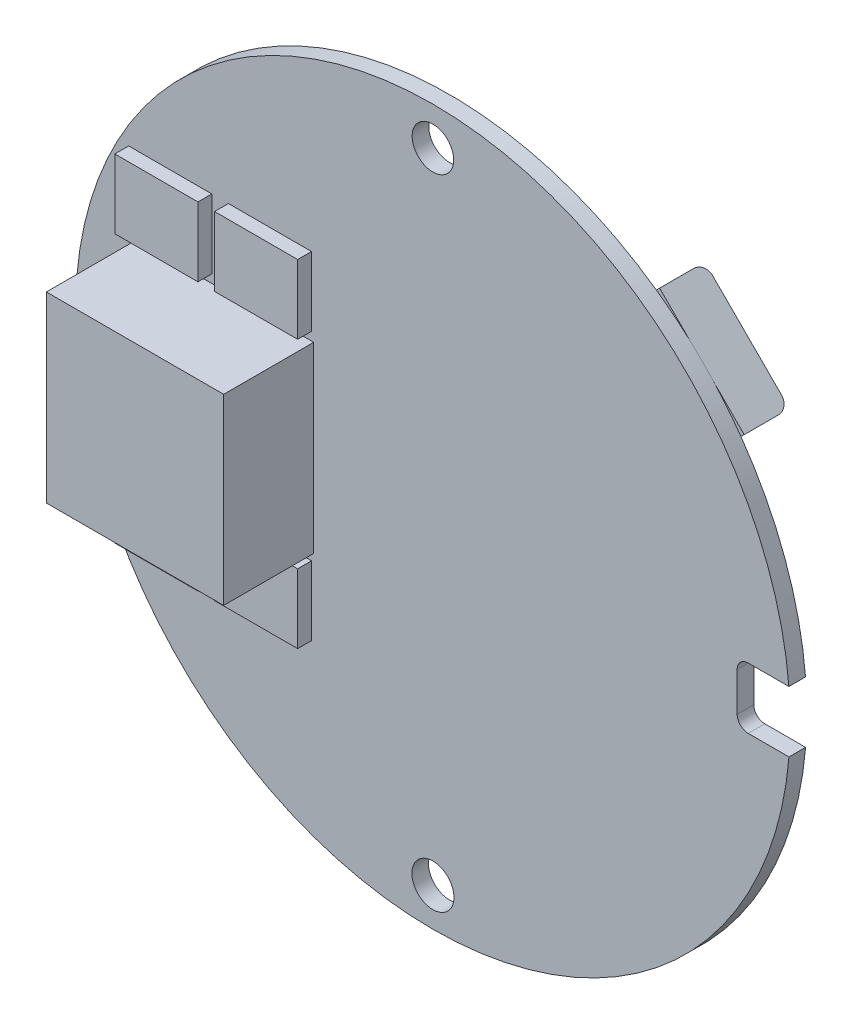
from build123d import *

# Parameters (mm, degrees)
EXTRUDE_START       = -49.800416
SKETCH_2_R          = 25.8
SKETCH_2_R_2        = 1.49999954
SKETCH_2_R_3        = 1.52
EXTRUDE_1_DEPTH     = 1.2
EXTRUDE_2_DEPTH     = 6.5
EXTRUDE_3_DEPTH     = 1
EXTRUDE_3_2_DEPTH   = 1
EXTRUDE_3_3_DEPTH   = 1
EXTRUDE_3_4_DEPTH   = 1
CUT_EXTRUDE_START   = -49.800416
CUT_EXTRUDE_2_DEPTH = 1.2
EXTRUDE_START_2     = -51.000416
EXTRUDE_4_DEPTH     = 3.26
FILLET_1_R          = 0.8


with BuildPart() as part:
    # 草图2 → 凸台-拉伸1 (new body)
    with BuildSketch(Plane.XY.offset(EXTRUDE_START)):
        with Locations(Location((-24.698490112, -1.512152456, 0), (0, 0, 180))):
            Circle(SKETCH_2_R)
        with Locations(Location((-24.699302249, 21.537658542, 0), (0, 0, 180))):
            Circle(SKETCH_2_R_2, mode=Mode.SUBTRACT)
        with Locations(Location((-24.698490112, -24.562152076, 0), (0, 0, 180))):
            Circle(SKETCH_2_R_3, mode=Mode.SUBTRACT)
    extrude(amount=-EXTRUDE_1_DEPTH)

    # 草图5 → 切除-拉伸2 (cut)
    with BuildSketch(Plane.XY.offset(CUT_EXTRUDE_START)):
        with BuildLine():
            Line((-46.664936261, -0.078657487), (-46.664936261, -2.878657487))
            ThreePointArc((-46.664936261, -2.878657487), (-46.899250836, -3.444342912), (-47.464936261, -3.678657487))
            Line((-47.464936261, -3.678657487), (-57.601175162, -3.678657487))
            Line((-57.601175162, -3.678657487), (-57.601175162, -1.478657487))
            Line((-57.601175162, -1.478657487), (-57.601175162, 0.721342513))
            Line((-57.601175162, 0.721342513), (-47.464936261, 0.721342513))
            ThreePointArc((-47.464936261, 0.721342513), (-46.899250836, 0.487027938), (-46.664936261, -0.078657487))
        make_face()
        with BuildLine():
            Line((-1.932043962, -3.678657487), (8.204194939, -3.678657487))
            Line((8.204194939, -3.678657487), (8.204194939, -1.478657487))
            Line((8.204194939, -1.478657487), (8.204194939, 0.721342513))
            Line((8.204194939, 0.721342513), (-1.932043962, 0.721342513))
            ThreePointArc((-1.932043962, 0.721342513), (-2.497729387, 0.487027938), (-2.732043962, -0.078657487))
            Line((-2.732043962, -0.078657487), (-2.732043962, -2.878657487))
            ThreePointArc((-2.732043962, -2.878657487), (-2.497729387, -3.444342912), (-1.932043962, -3.678657487))
        make_face()
    extrude(amount=-CUT_EXTRUDE_2_DEPTH, mode=Mode.SUBTRACT)

    # 草图6 → 凸台-拉伸4 (add)
    with BuildSketch(Plane.XY.offset(EXTRUDE_START_2)):
        Polygon((-14.569549448, 14.416291987), (-8.617406593, 8.459528473), (-3.420171752, 13.656763315), (-9.529574341, 19.766165904), align=None)
    extrude(amount=-EXTRUDE_4_DEPTH)

    # 圆角1
    fillet_1_edges = [part.edges().sort_by_distance(p)[0] for p in [
        (-12.049561894, 17.091228946, -54.260416),
        (-6.018789173, 11.058145894, -54.260416),
    ]]
    fillet(fillet_1_edges, radius=FILLET_1_R)


with BuildPart() as body_2:
    # 草图3 → 凸台-拉伸2 (new body)
    with BuildSketch(Plane.XY.offset(EXTRUDE_START)):
        Polygon((-46.106203951, -1.512152456), (-46.106203951, 5.087847544), (-33.306203951, 5.087847544), (-33.306203951, -8.112152456), (-46.106203951, -8.112152456), align=None)
    extrude(amount=EXTRUDE_2_DEPTH)


with BuildPart() as body_3:
    # 草图4 → 凸台-拉伸3 (new body)
    with BuildSketch(Plane.XY.offset(EXTRUDE_START)):
        Polygon((-39.464936268, -8.64507071), (-39.464171207, -13.645070651), (-33.464171277, -13.644152578), (-33.464934728, -8.654677262), align=None)
    extrude(amount=EXTRUDE_3_DEPTH)


with BuildPart() as body_4:
    # 草图4 → Extrude 3 2 (new body)
    with BuildSketch(Plane.XY.offset(EXTRUDE_START)):
        Polygon((-33.464934728, 5.697362288), (-39.464936268, 5.687755735), (-39.464171207, 10.687755677), (-33.464171277, 10.686837604), align=None)
    extrude(amount=EXTRUDE_3_2_DEPTH)


with BuildPart() as body_5:
    # 草图4 → Extrude 3 3 (new body)
    with BuildSketch(Plane.XY.offset(EXTRUDE_START)):
        Polygon((-40.664936261, 5.687847542), (-40.664936261, 10.687847542), (-46.664936261, 10.687847542), (-46.664936261, 5.698372168), align=None)
    extrude(amount=EXTRUDE_3_3_DEPTH)


with BuildPart() as body_6:
    # 草图4 → Extrude 3 4 (new body)
    with BuildSketch(Plane.XY.offset(EXTRUDE_START)):
        Polygon((-46.664936261, -8.655687143), (-40.664936261, -8.645162517), (-40.664936261, -13.645162517), (-46.664936261, -13.645162517), align=None)
    extrude(amount=EXTRUDE_3_4_DEPTH)


solid = Compound([part.part, body_2.part, body_3.part, body_4.part, body_5.part, body_6.part])
